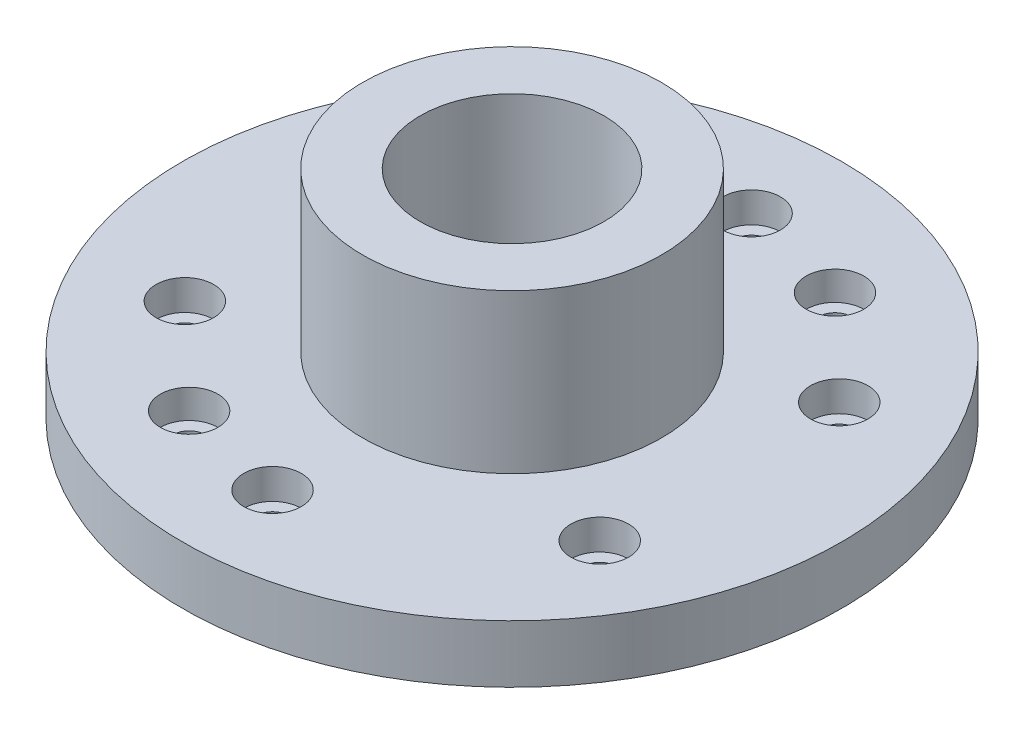
from build123d import *

# Parameters (mm, degrees)
CBORE_FOR_M4_SHCS3_D           = 4.5
CBORE_FOR_M4_SHCS3_CBORE_D     = 8
CBORE_FOR_M4_SHCS3_CBORE_DEPTH = 4.2
CBORE_FOR_M4_SHCS4_D           = 4.5
CBORE_FOR_M4_SHCS4_CBORE_D     = 8
CBORE_FOR_M4_SHCS4_CBORE_DEPTH = 4


with BuildPart() as part:
    # Sketch1 → Revolve1 (revolve)
    with BuildSketch(Plane(origin=(0, 0, 0), x_dir=(0, 0, -1), z_dir=(1, 0, 0)), mode=Mode.PRIVATE) as revolve1_sk:
        Polygon((-12.75, 0), (-45.75, 0), (-45.75, 8), (-20.75, 8), (-20.75, 30), (-12.75, 30), align=None)
    revolve(revolve1_sk.sketch.rotate(Axis((0, -55, 0), (0, 1, 0)), 180), axis=Axis((0, -55, 0), (0, 1, 0)))

    # CBORE for M4 SHCS3 (through all)
    with Locations(Plane(origin=(0, 8, 0), x_dir=(1, 0, 0), z_dir=(0, 1, 0))):
        with Locations((0, 33.25), (28.795344676, 16.625), (28.795344676, -16.625), (0, -33.25), (-28.795344676, -16.625), (-28.795344676, 16.625)):
            CounterBoreHole(CBORE_FOR_M4_SHCS3_D / 2, CBORE_FOR_M4_SHCS3_CBORE_D / 2, CBORE_FOR_M4_SHCS3_CBORE_DEPTH)

    # CBORE for M4 SHCS4 (through all)
    with Locations(Plane(origin=(0, 8, 0), x_dir=(1, 0, 0), z_dir=(0, 1, 0))):
        with Locations((15.313173529, 29.513881759), (-15.313173529, -29.513881759)):
            CounterBoreHole(CBORE_FOR_M4_SHCS4_D / 2, CBORE_FOR_M4_SHCS4_CBORE_D / 2, CBORE_FOR_M4_SHCS4_CBORE_DEPTH)


solid = part.part
